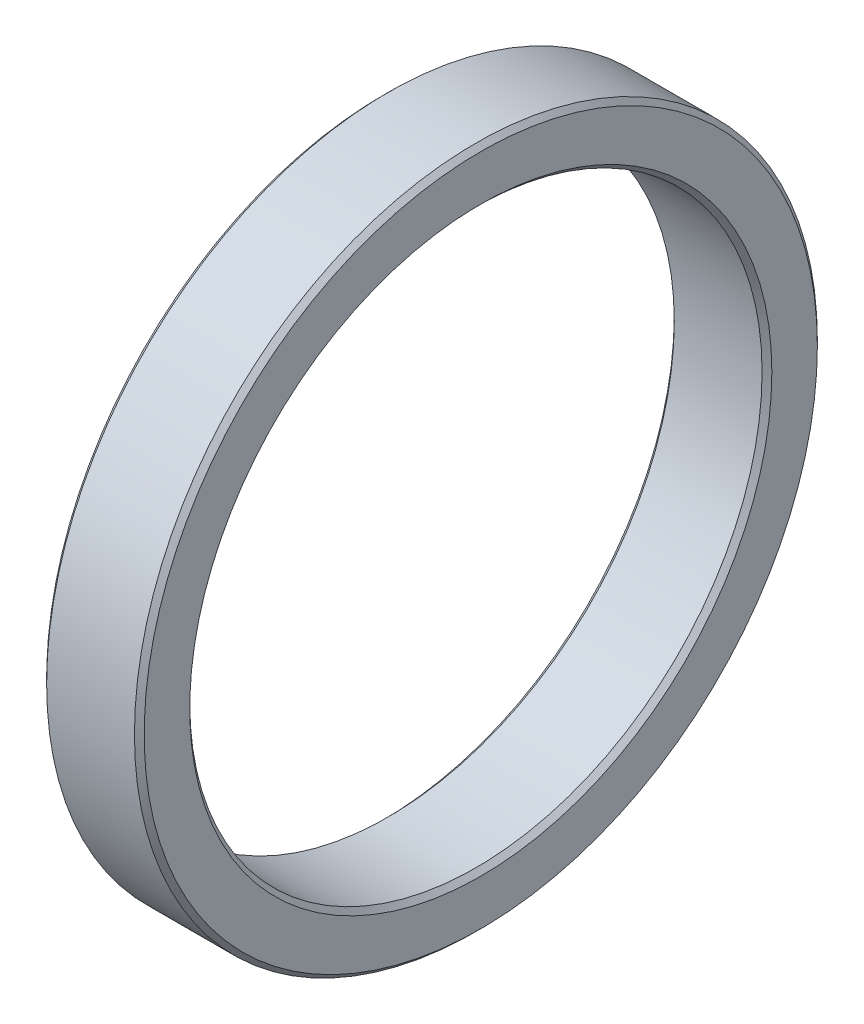
from build123d import *

# Parameters (mm, degrees)
SKETCH_1_R      = 21
SKETCH_1_R_2    = 17.6
EXTRUDE_1_DEPTH = 6
CHAMFER_1_SIZE  = 0.3


with BuildPart() as part:
    # 草图1 → 凸台-拉伸1 (new body)
    with BuildSketch(Plane(origin=(0, 0, 0), x_dir=(0, 0, -1), z_dir=(1, 0, 0))):
        Circle(SKETCH_1_R)
        Circle(SKETCH_1_R_2, mode=Mode.SUBTRACT)
    extrude(amount=EXTRUDE_1_DEPTH)

    # 倒角1
    chamfer_1_edges = [part.edges().sort_by_distance(p)[0] for p in [
        (0, 0, 21),
        (6, 0, 21),
        (0, 0, 17.6),
        (6, 0, 17.6),
    ]]
    chamfer(chamfer_1_edges, length=CHAMFER_1_SIZE)


solid = part.part
